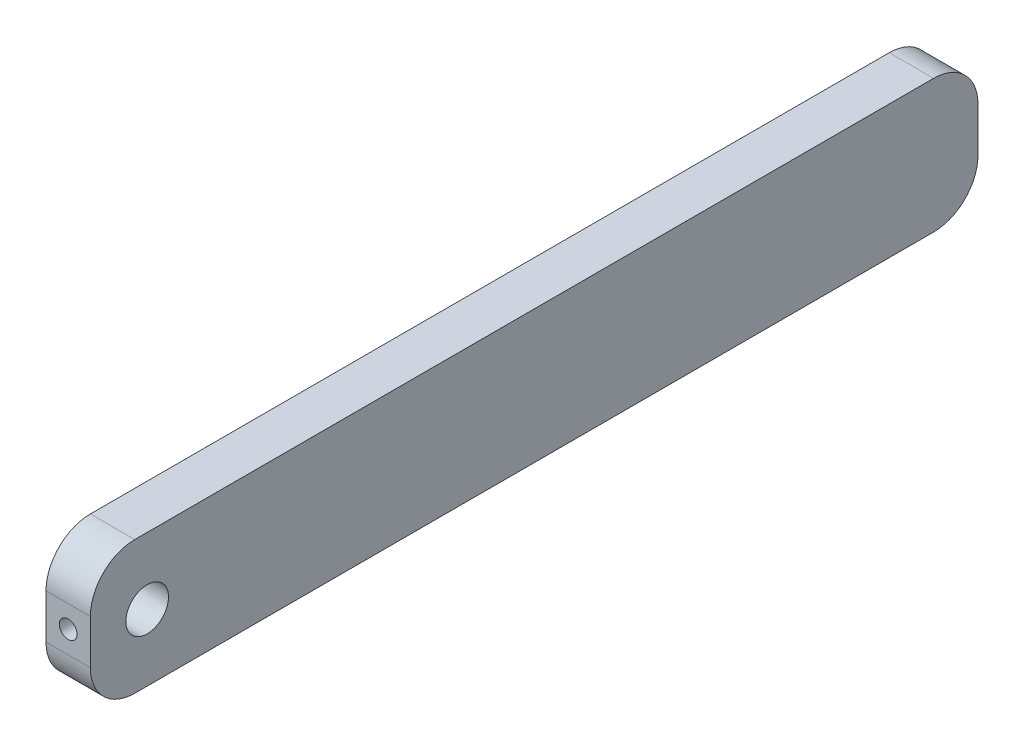
from build123d import *

# Parameters (mm, degrees)
SKETCH_1_W          = 100
SKETCH_1_H          = 15
EXTRUDE_1_DEPTH     = 5
SKETCH_2_R          = 2.4
CUT_EXTRUDE_1_DEPTH = 5
FILLET_1_R          = 5
SKETCH_4_R          = 1
CUT_EXTRUDE_2_DEPTH = 7


with BuildPart() as part:
    # 草图1 → 凸台-拉伸1 (new body)
    with BuildSketch(Plane(origin=(0, 0, 0), x_dir=(0, 0, -1), z_dir=(1, 0, 0))):
        with Locations((50, 7.5)):
            Rectangle(SKETCH_1_W, SKETCH_1_H)
    extrude(amount=EXTRUDE_1_DEPTH)

    # 草图2 → 切除-拉伸1 (cut)
    with BuildSketch(Plane(origin=(5, 0, 0), x_dir=(0, 0, -1), z_dir=(1, 0, 0))):
        with Locations((6.4, 7.5)):
            Circle(SKETCH_2_R)
    extrude(amount=-CUT_EXTRUDE_1_DEPTH, mode=Mode.SUBTRACT)

    # 圆角1
    fillet_1_edges = [part.edges().sort_by_distance(p)[0] for p in [
        (2.5, 15, 0),
        (2.5, 15, -100),
        (2.5, 0, -100),
        (2.5, 0, 0),
    ]]
    fillet(fillet_1_edges, radius=FILLET_1_R)

    # 草图4 → 切除-拉伸2 (cut)
    with BuildSketch(Plane.XY):
        with Locations((2.5, 7.5)):
            Circle(SKETCH_4_R)
    extrude(amount=-CUT_EXTRUDE_2_DEPTH, mode=Mode.SUBTRACT)


solid = part.part
